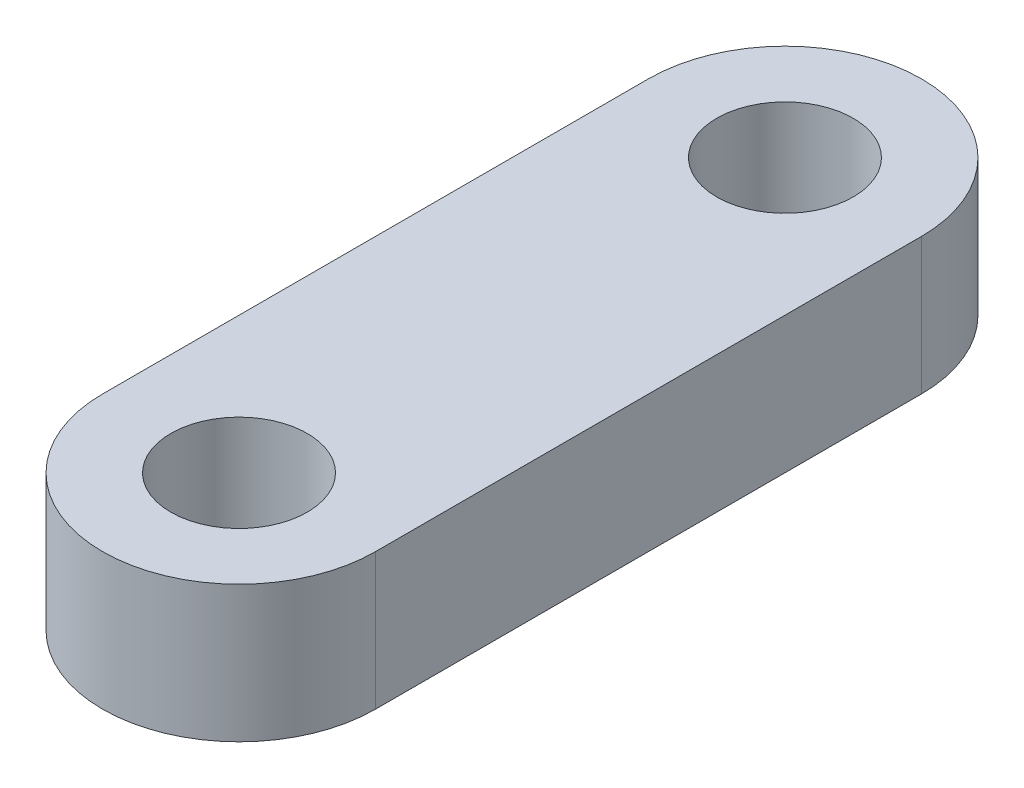
from build123d import *

# Parameters (mm, degrees)
BOSS_EXTRUDE1_DEPTH = 5
SKETCH2_R           = 2.5
CUT_EXTRUDE1_DEPTH  = 17.583123952


with BuildPart() as part:
    # Sketch1 → Boss-Extrude1 (new body)
    with BuildSketch(Plane(origin=(0, 0, 0), x_dir=(1, 0, 0), z_dir=(0, 1, 0))):
        with BuildLine():
            Line((-5, -10), (-5, 10))
            ThreePointArc((-5, 10), (0, 15), (5, 10))
            Line((5, 10), (5, -10))
            ThreePointArc((5, -10), (0, -15), (-5, -10))
        make_face()
    extrude(amount=BOSS_EXTRUDE1_DEPTH)

    # Sketch2 → Cut-Extrude1 (cut, through all)
    with BuildSketch(Plane(origin=(0, 5, 0), x_dir=(1, 0, 0), z_dir=(0, 1, 0))):
        with Locations(Location((0, 10, 0), (0, 0, 270))):
            Circle(SKETCH2_R)
        with Locations(Location((0, -10, 0), (0, 0, 270))):
            Circle(SKETCH2_R)
    extrude(amount=-CUT_EXTRUDE1_DEPTH, mode=Mode.SUBTRACT)


solid = part.part
